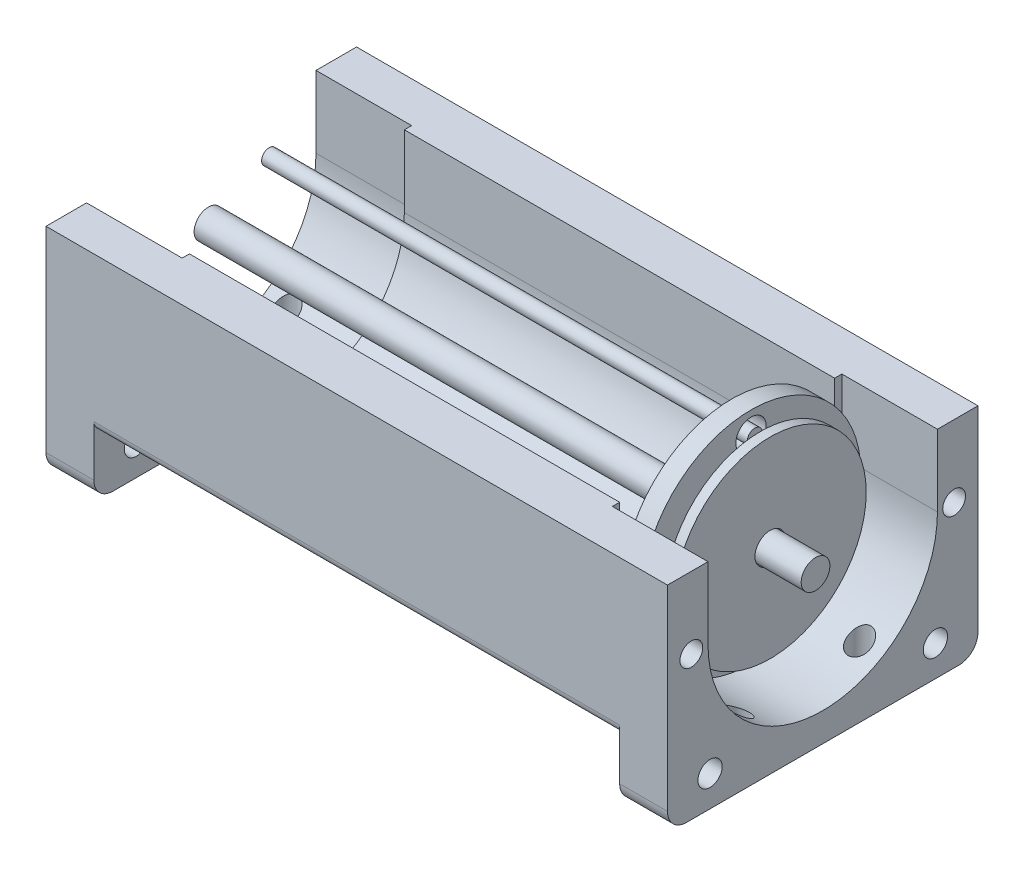
from build123d import *

# Parameters (mm, degrees)
SKETCH1_R             = 2.38125
BOSS_EXTRUDE1_DEPTH   = 45
SKETCH3_R             = 23
SKETCH3_R_2           = 3.175
BOSS_EXTRUDE2_DEPTH   = 4
SKETCH17_R            = 20.1
SKETCH17_R_2          = 3.175
BOSS_EXTRUDE4_DEPTH   = 2
SKETCH19_R            = 3
BOSS_EXTRUDE6_DEPTH   = 63.5
SKETCH20_R            = 1.5875
BOSS_EXTRUDE7_DEPTH   = 50.8
BOSS_EXTRUDE7_2_DEPTH = 50.8
BOSS_EXTRUDE7_3_DEPTH = 50.8
BOSS_EXTRUDE7_4_DEPTH = 50.8
BOSS_EXTRUDE8_START   = 10
SKETCH21_R            = 2.38125
BOSS_EXTRUDE8_DEPTH   = 10
BOSS_EXTRUDE9_START   = 10
SKETCH23_R            = 2.54
SKETCH23_R_2          = 2.38125
BOSS_EXTRUDE9_DEPTH   = 10
SKETCH24_R            = 2.38125
CUT_EXTRUDE1_DEPTH    = 50
SKETCH25_R            = 2.38125
BOSS_EXTRUDE10_DEPTH  = 10
SKETCH27_R            = 2.54
SKETCH27_R_2          = 2.38125
BOSS_EXTRUDE11_DEPTH  = 10


with BuildPart() as part:
    # Sketch1 → Boss-Extrude1 (new, symmetric)
    with BuildSketch(Plane(origin=(0, 0, 0), x_dir=(0, 0, -1), z_dir=(1, 0, 0))):
        with BuildLine():
            Line((-22.48125, 0), (-22.48125, 15))
            Line((-22.48125, 15), (-32.48125, 15))
            Line((-32.48125, 15), (-32.48125, -15.371))
            ThreePointArc((-32.48125, -15.371), (-31.895463562, -16.785213562), (-30.48125, -17.371))
            Line((-30.48125, -17.371), (-23.31225, -17.371))
            ThreePointArc((-23.31225, -17.371), (-19.069609313, -19.128359313), (-17.31225, -23.371))
            Line((-17.31225, -23.371), (-17.31225, -28))
            ThreePointArc((-17.31225, -28), (-16.726463562, -29.414213562), (-15.31225, -30))
            Line((-15.31225, -30), (15.42975, -30))
            ThreePointArc((15.42975, -30), (16.843963562, -29.414213562), (17.42975, -28))
            Line((17.42975, -28), (17.42975, -23.371))
            ThreePointArc((17.42975, -23.371), (19.187109313, -19.128359313), (23.42975, -17.371))
            Line((23.42975, -17.371), (30.05875, -17.371))
            Line((30.05875, -17.371), (30.48125, -17.371))
            ThreePointArc((30.48125, -17.371), (31.895463562, -16.785213562), (32.48125, -15.371))
            Line((32.48125, -15.371), (32.48125, 15))
            Line((32.48125, 15), (22.48125, 15))
            Line((22.48125, 15), (22.48125, 0))
            ThreePointArc((22.48125, 0), (0, -22.48125), (-22.48125, 0))
        make_face()
        with Locations(Location((-27.48125, 0, 0), (0, 0, 180))):
            Circle(SKETCH1_R, mode=Mode.SUBTRACT)
        with Locations(Location((27.48125, 0, 0), (0, 0, 180))):
            Circle(SKETCH1_R, mode=Mode.SUBTRACT)
    extrude(amount=BOSS_EXTRUDE1_DEPTH, both=True)

    # Sketch21 → Boss-Extrude8 (add)
    with BuildSketch(Plane(origin=(45, 0, 0), x_dir=(0, 0, -1), z_dir=(1, 0, 0)).offset(BOSS_EXTRUDE8_START)):
        with BuildLine():
            Line((-24, 0), (-24, 15))
            Line((-24, 15), (-32.48125, 15))
            Line((-32.48125, 15), (-32.48125, -15.371))
            ThreePointArc((-32.48125, -15.371), (-31.895463562, -16.785213562), (-30.48125, -17.371))
            Line((-30.48125, -17.371), (-23.31225, -17.371))
            ThreePointArc((-23.31225, -17.371), (-19.069609313, -19.128359313), (-17.31225, -23.371))
            Line((-17.31225, -23.371), (-17.31225, -28))
            ThreePointArc((-17.31225, -28), (-16.726463562, -29.414213562), (-15.31225, -30))
            Line((-15.31225, -30), (15.42975, -30))
            ThreePointArc((15.42975, -30), (16.843963562, -29.414213562), (17.42975, -28))
            Line((17.42975, -28), (17.42975, -23.371))
            ThreePointArc((17.42975, -23.371), (19.187109313, -19.128359313), (23.42975, -17.371))
            Line((23.42975, -17.371), (30.05875, -17.371))
            Line((30.05875, -17.371), (30.48125, -17.371))
            ThreePointArc((30.48125, -17.371), (31.895463562, -16.785213562), (32.48125, -15.371))
            Line((32.48125, -15.371), (32.48125, 15))
            Line((32.48125, 15), (24, 15))
            Line((24, 15), (24, 0))
            ThreePointArc((24, 0), (0, -24), (-24, 0))
        make_face()
        with Locations(Location((-27.48125, 0, 0), (0, 0, 180))):
            Circle(SKETCH21_R, mode=Mode.SUBTRACT)
        with Locations(Location((27.48125, 0, 0), (0, 0, 180))):
            Circle(SKETCH21_R, mode=Mode.SUBTRACT)
    extrude(amount=-BOSS_EXTRUDE8_DEPTH)

    # Sketch23 → Boss-Extrude9 (add)
    with BuildSketch(Plane(origin=(55, 0, 0), x_dir=(0, 0, -1), z_dir=(1, 0, 0)).offset(BOSS_EXTRUDE9_START)):
        with BuildLine():
            Line((-24, 0), (-24, 15))
            Line((-24, 15), (-32.48125, 15))
            Line((-32.48125, 15), (-32.48125, -26))
            ThreePointArc((-32.48125, -26), (-31.309677125, -28.828427125), (-28.48125, -30))
            Line((-28.48125, -30), (28.48125, -30))
            ThreePointArc((28.48125, -30), (31.309677125, -28.828427125), (32.48125, -26))
            Line((32.48125, -26), (32.48125, 15))
            Line((32.48125, 15), (24, 15))
            Line((24, 15), (24, 0))
            ThreePointArc((24, 0), (0, -24), (-24, 0))
        make_face()
        with Locations((-23.5712, -23.5712)):
            Circle(SKETCH23_R, mode=Mode.SUBTRACT)
        with Locations((23.5712, -23.5712)):
            Circle(SKETCH23_R, mode=Mode.SUBTRACT)
        with Locations(Location((-27.48125, 0, 0), (0, 0, 180))):
            Circle(SKETCH23_R_2, mode=Mode.SUBTRACT)
        with Locations(Location((27.48125, 0, 0), (0, 0, 180))):
            Circle(SKETCH23_R_2, mode=Mode.SUBTRACT)
    extrude(amount=-BOSS_EXTRUDE9_DEPTH)

    # Sketch24 → Cut-Extrude1 (cut)
    with BuildSketch(Plane.XZ.offset(30)):
        with Locations(Location((60, 12.7, 0), (0, 0, 270))):
            Circle(SKETCH24_R)
        with Locations(Location((60, -12.7, 0), (0, 0, 270))):
            Circle(SKETCH24_R)
    cut_extrude1 = extrude(amount=-CUT_EXTRUDE1_DEPTH, mode=Mode.SUBTRACT)

    # Sketch25 → Boss-Extrude10 (add)
    with BuildSketch(Plane.ZY.offset(45)):
        with BuildLine():
            Line((-24, 0), (-24, 15))
            Line((-24, 15), (-32.48125, 15))
            Line((-32.48125, 15), (-32.48125, -15.371))
            ThreePointArc((-32.48125, -15.371), (-31.895463562, -16.785213562), (-30.48125, -17.371))
            Line((-30.48125, -17.371), (-23.31225, -17.371))
            ThreePointArc((-23.31225, -17.371), (-19.069609313, -19.128359313), (-17.31225, -23.371))
            Line((-17.31225, -23.371), (-17.31225, -28))
            ThreePointArc((-17.31225, -28), (-16.726463562, -29.414213562), (-15.31225, -30))
            Line((-15.31225, -30), (15.42975, -30))
            ThreePointArc((15.42975, -30), (16.843963562, -29.414213562), (17.42975, -28))
            Line((17.42975, -28), (17.42975, -23.371))
            ThreePointArc((17.42975, -23.371), (19.187109313, -19.128359313), (23.42975, -17.371))
            Line((23.42975, -17.371), (30.05875, -17.371))
            Line((30.05875, -17.371), (30.48125, -17.371))
            ThreePointArc((30.48125, -17.371), (31.895463562, -16.785213562), (32.48125, -15.371))
            Line((32.48125, -15.371), (32.48125, 15))
            Line((32.48125, 15), (24, 15))
            Line((24, 15), (24, 0))
            ThreePointArc((24, 0), (0, -24), (-24, 0))
        make_face()
        with Locations((-27.48125, 0)):
            Circle(SKETCH25_R, mode=Mode.SUBTRACT)
        with Locations((27.48125, 0)):
            Circle(SKETCH25_R, mode=Mode.SUBTRACT)
    extrude(amount=BOSS_EXTRUDE10_DEPTH)

    # Sketch27 → Boss-Extrude11 (add)
    with BuildSketch(Plane.ZY.offset(55)):
        with BuildLine():
            Line((-24, 0), (-24, 15))
            Line((-24, 15), (-32.48125, 15))
            Line((-32.48125, 15), (-32.48125, -26))
            ThreePointArc((-32.48125, -26), (-31.309677125, -28.828427125), (-28.48125, -30))
            Line((-28.48125, -30), (28.48125, -30))
            ThreePointArc((28.48125, -30), (31.309677125, -28.828427125), (32.48125, -26))
            Line((32.48125, -26), (32.48125, 15))
            Line((32.48125, 15), (24, 15))
            Line((24, 15), (24, 0))
            ThreePointArc((24, 0), (0, -24), (-24, 0))
        make_face()
        with Locations(Location((-23.5712, -23.5712, 0), (0, 0, 180))):
            Circle(SKETCH27_R, mode=Mode.SUBTRACT)
        with Locations(Location((23.5712, -23.5712, 0), (0, 0, 180))):
            Circle(SKETCH27_R, mode=Mode.SUBTRACT)
        with Locations((-27.48125, 0)):
            Circle(SKETCH27_R_2, mode=Mode.SUBTRACT)
        with Locations((27.48125, 0)):
            Circle(SKETCH27_R_2, mode=Mode.SUBTRACT)
    extrude(amount=BOSS_EXTRUDE11_DEPTH)

    # Mirror6: Cut-Extrude1 across plane
    add(cut_extrude1.mirror(Plane(origin=(0, 0, 0), x_dir=(0, 0, 1), z_dir=(1, 0, 0))), mode=Mode.SUBTRACT)


with BuildPart() as body_2:
    # Sketch3 → Boss-Extrude2 (new body)
    with BuildSketch(Plane(origin=(46, 0, 0), x_dir=(0, 0, -1), z_dir=(1, 0, 0))):
        Circle(SKETCH3_R)
        Circle(SKETCH3_R_2, mode=Mode.SUBTRACT)
        with Locations((0, 18.5125)):
            Circle(SKETCH3_R_2, mode=Mode.SUBTRACT)
        with Locations((-18.5125, 0)):
            Circle(SKETCH3_R_2, mode=Mode.SUBTRACT)
        with Locations((0, -18.5125)):
            Circle(SKETCH3_R_2, mode=Mode.SUBTRACT)
        with Locations((18.5125, 0)):
            Circle(SKETCH3_R_2, mode=Mode.SUBTRACT)
    extrude(amount=BOSS_EXTRUDE2_DEPTH)


with BuildPart() as body_3:
    # Sketch17 → Boss-Extrude4 (new body)
    with BuildSketch(Plane(origin=(52, 0, 0), x_dir=(0, 0, -1), z_dir=(1, 0, 0))):
        Circle(SKETCH17_R)
        Circle(SKETCH17_R_2, mode=Mode.SUBTRACT)
    extrude(amount=BOSS_EXTRUDE4_DEPTH)


with BuildPart() as body_4:
    # Sketch19 → Boss-Extrude6 (new, symmetric)
    with BuildSketch(Plane(origin=(0, 0, 0), x_dir=(0, 0, -1), z_dir=(1, 0, 0))):
        Circle(SKETCH19_R)
    extrude(amount=BOSS_EXTRUDE6_DEPTH, both=True)


with BuildPart() as body_5:
    # Sketch20 → Boss-Extrude7 (new, symmetric)
    with BuildSketch(Plane(origin=(0, 0, 0), x_dir=(0, 0, -1), z_dir=(1, 0, 0))):
        with Locations((0, 18.5125)):
            Circle(SKETCH20_R)
    extrude(amount=BOSS_EXTRUDE7_DEPTH, both=True)


with BuildPart() as body_6:
    # Sketch20 → Boss-Extrude7 2 (new, symmetric)
    with BuildSketch(Plane(origin=(0, 0, 0), x_dir=(0, 0, -1), z_dir=(1, 0, 0))):
        with Locations((18.5125, 0)):
            Circle(SKETCH20_R)
    extrude(amount=BOSS_EXTRUDE7_2_DEPTH, both=True)


with BuildPart() as body_7:
    # Sketch20 → Boss-Extrude7 3 (new, symmetric)
    with BuildSketch(Plane(origin=(0, 0, 0), x_dir=(0, 0, -1), z_dir=(1, 0, 0))):
        with Locations((0, -18.5125)):
            Circle(SKETCH20_R)
    extrude(amount=BOSS_EXTRUDE7_3_DEPTH, both=True)


with BuildPart() as body_8:
    # Sketch20 → Boss-Extrude7 4 (new, symmetric)
    with BuildSketch(Plane(origin=(0, 0, 0), x_dir=(0, 0, -1), z_dir=(1, 0, 0))):
        with Locations((-18.5125, 0)):
            Circle(SKETCH20_R)
    extrude(amount=BOSS_EXTRUDE7_4_DEPTH, both=True)


solid = Compound([part.part, body_2.part, body_3.part, body_4.part, body_5.part, body_6.part, body_7.part, body_8.part])
